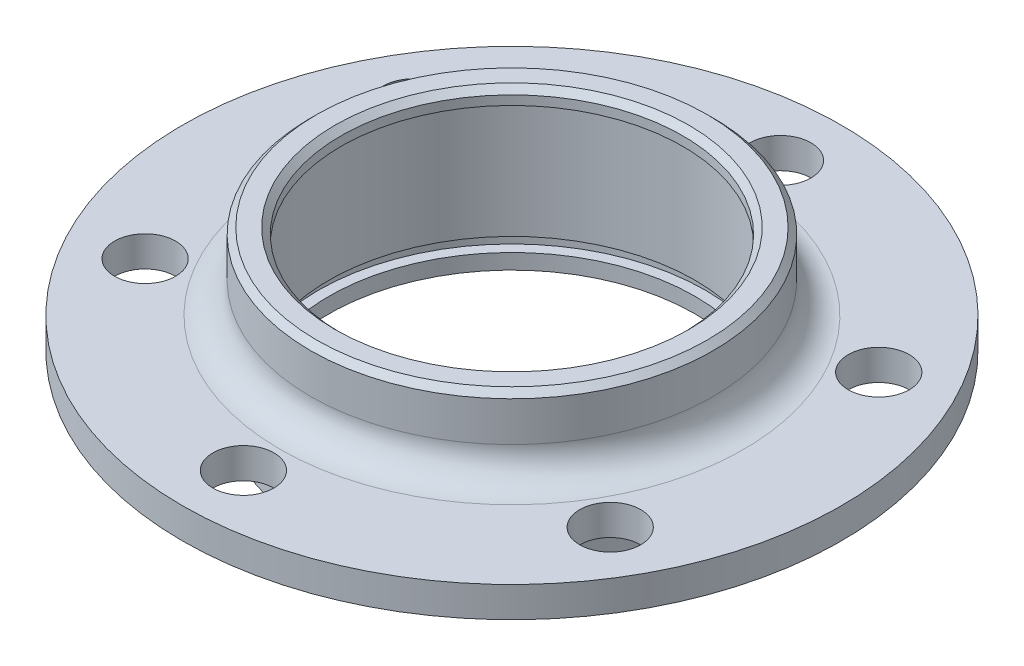
from build123d import *

# Parameters (mm, degrees)
SKETCH1_R           = 27
SKETCH1_R_2         = 2.5
SKETCH1_R_3         = 16.5
BOSS_EXTRUDE1_DEPTH = 2.5
FILLET1_R           = 2.5


with BuildPart() as part:
    # Sketch1 → Boss-Extrude1 (new body)
    with BuildSketch(Plane(origin=(0, 0, 0), x_dir=(1, 0, 0), z_dir=(0, 1, 0))):
        Circle(SKETCH1_R)
        with Locations((0, 22)):
            Circle(SKETCH1_R_2, mode=Mode.SUBTRACT)
        with Locations((19.052558883, 11)):
            Circle(SKETCH1_R_2, mode=Mode.SUBTRACT)
        with Locations((19.052558883, -11)):
            Circle(SKETCH1_R_2, mode=Mode.SUBTRACT)
        with Locations((0, -22)):
            Circle(SKETCH1_R_2, mode=Mode.SUBTRACT)
        with Locations((-19.052558883, -11)):
            Circle(SKETCH1_R_2, mode=Mode.SUBTRACT)
        with Locations((-19.052558883, 11)):
            Circle(SKETCH1_R_2, mode=Mode.SUBTRACT)
        Circle(SKETCH1_R_3, mode=Mode.SUBTRACT)
    extrude(amount=-BOSS_EXTRUDE1_DEPTH)

    # Sketch4 → Revolve1 (revolve)
    with BuildSketch(Plane(origin=(0, 0, 0), x_dir=(0, 0, -1), z_dir=(1, 0, 0))):
        Polygon((-16.5, -6.89), (-16.5, 5.75), (-16, 6.25), (-14.992862102, 6.25), (-14.5, 6.25), (-14, 5.75), (-14, 5), (-15, 5), (-15, -5), (-15.855, -5), (-15.855, -6.14), (-15, -6.14), (-15, -7.39), (-16, -7.39), align=None)
    revolve(axis=Axis((0, 12.74988571, 0), (0, -1, 0)))

    # Fillet1
    fillet1_edges = [part.edges().sort_by_distance(p)[0] for p in [
        (0, 0, -16.5),
    ]]
    fillet(fillet1_edges, radius=FILLET1_R)


solid = part.part
